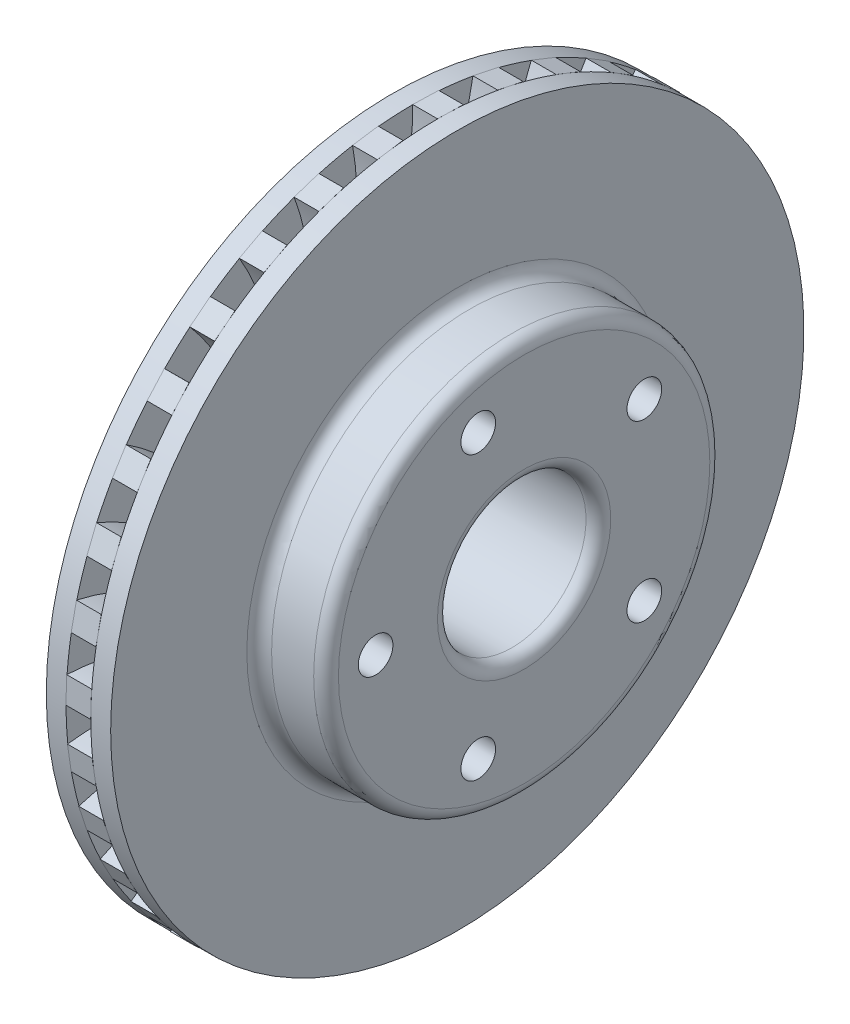
from build123d import *

# Parameters (mm, degrees)
BOSS_EXTRUDE1_DEPTH            = 10
CIRPATTERN1_COUNT              = 36
CUT_EXTRUDE1_REACH             = 215.623
SKETCH4_R                      = 7
CUT_EXTRUDE1_DIRECTION_2_DEPTH = 214.62310931


with BuildPart() as part:
    # Sketch1 → Revolve1 (revolve)
    with BuildSketch(Plane.XY, mode=Mode.PRIVATE) as revolve1_sk:
        with BuildLine():
            Line((13, 140), (13, 85))
            ThreePointArc((13, 85), (14.464466094, 81.464466094), (18, 80))
            Line((18, 80), (35, 80))
            ThreePointArc((35, 80), (38.535533906, 78.535533906), (40, 75))
            Line((40, 75), (40, 35))
            ThreePointArc((40, 35), (38.535533906, 31.464466094), (35, 30))
            Line((35, 30), (-35, 30))
            ThreePointArc((-35, 30), (-38.535533906, 31.464466094), (-40, 35))
            Line((-40, 35), (-40, 75))
            ThreePointArc((-40, 75), (-38.535533906, 78.535533906), (-35, 80))
            Line((-35, 80), (-18, 80))
            ThreePointArc((-18, 80), (-14.464466094, 81.464466094), (-13, 85))
            Line((-13, 85), (-13, 140))
            Line((-13, 140), (-5, 140))
            Line((-5, 140), (-5, 55))
            ThreePointArc((-5, 55), (-6.464466094, 51.464466094), (-10, 50))
            Line((-10, 50), (-25, 50))
            ThreePointArc((-25, 50), (-28.535533906, 48.535533906), (-30, 45))
            Line((-30, 45), (-30, 40))
            ThreePointArc((-30, 40), (-28.535533906, 36.464466094), (-25, 35))
            Line((-25, 35), (15, 35))
            ThreePointArc((15, 35), (18.535533906, 36.464466094), (20, 40))
            Line((20, 40), (20, 50))
            ThreePointArc((20, 50), (18.535533906, 53.535533906), (15, 55))
            Line((15, 55), (5, 55))
            Line((5, 55), (5, 140))
            Line((5, 140), (13, 140))
        make_face()
    revolve(revolve1_sk.sketch.rotate(Axis((-87.208333333, 0, 0), (1, 0, 0)), 90), axis=Axis((-87.208333333, 0, 0), (1, 0, 0)))

    # Sketch3 → Boss-Extrude1 (add)
    with BuildSketch(Plane(origin=(-5, 0, 0), x_dir=(0, 0, -1), z_dir=(1, 0, 0))):
        with BuildLine():
            Line((-0.000774849, 140.062187673), (10.499225151, 139.749248462))
            ThreePointArc((10.499225151, 139.749248462), (3.423085342, 107.196144199), (-13.953427537, 78.77373839))
            Line((-13.953427537, 78.77373839), (-21.268173939, 77.121104617))
            ThreePointArc((-21.268173939, 77.121104617), (-5.254701729, 106.773854542), (-0.000774849, 140.062187673))
        make_face()
    boss_extrude1 = extrude(amount=BOSS_EXTRUDE1_DEPTH)

    # CirPattern1: Boss-Extrude1 ×36 about axis
    cirpattern1_axis = Axis((0, 0, 0), (1, 0, 0))
    for i in range(1, CIRPATTERN1_COUNT):
        add(boss_extrude1.rotate(cirpattern1_axis, i * 360 / CIRPATTERN1_COUNT))

    # Cut-Extrude1: up to this face of the body (flat: up to its plane)
    cut_extrude1_end = Plane(part.part.faces().sort_by_distance((40, 0, -72.878679656))[0])
    # Sketch4 → Cut-Extrude1 (cut, up to the picked face)
    with BuildSketch(Plane.ZY.offset(40), mode=Mode.PRIVATE) as cut_extrude1_sk1:
        with Locations((60, 0)):
            Circle(SKETCH4_R)
    cut_extrude1_tool1 = split(extrude(cut_extrude1_sk1.sketch, amount=-CUT_EXTRUDE1_REACH, mode=Mode.PRIVATE), bisect_by=cut_extrude1_end, keep=Keep.BOTH, mode=Mode.PRIVATE)
    # Sketch4 → Cut-Extrude1 (cut, up to the picked face)
    with BuildSketch(Plane.ZY.offset(40), mode=Mode.PRIVATE) as cut_extrude1_sk2:
        with Locations((18.541019662, -57.063390978)):
            Circle(SKETCH4_R)
    cut_extrude1_tool2 = split(extrude(cut_extrude1_sk2.sketch, amount=-CUT_EXTRUDE1_REACH, mode=Mode.PRIVATE), bisect_by=cut_extrude1_end, keep=Keep.BOTH, mode=Mode.PRIVATE)
    # Sketch4 → Cut-Extrude1 (cut, up to the picked face)
    with BuildSketch(Plane.ZY.offset(40), mode=Mode.PRIVATE) as cut_extrude1_sk3:
        with Locations((-48.541019662, -35.267115138)):
            Circle(SKETCH4_R)
    cut_extrude1_tool3 = split(extrude(cut_extrude1_sk3.sketch, amount=-CUT_EXTRUDE1_REACH, mode=Mode.PRIVATE), bisect_by=cut_extrude1_end, keep=Keep.BOTH, mode=Mode.PRIVATE)
    # Sketch4 → Cut-Extrude1 (cut, up to the picked face)
    with BuildSketch(Plane.ZY.offset(40), mode=Mode.PRIVATE) as cut_extrude1_sk4:
        with Locations((-48.541019662, 35.267115138)):
            Circle(SKETCH4_R)
    cut_extrude1_tool4 = split(extrude(cut_extrude1_sk4.sketch, amount=-CUT_EXTRUDE1_REACH, mode=Mode.PRIVATE), bisect_by=cut_extrude1_end, keep=Keep.BOTH, mode=Mode.PRIVATE)
    # Sketch4 → Cut-Extrude1 (cut, up to the picked face)
    with BuildSketch(Plane.ZY.offset(40), mode=Mode.PRIVATE) as cut_extrude1_sk5:
        with Locations((18.541019662, 57.063390978)):
            Circle(SKETCH4_R)
    cut_extrude1_tool5 = split(extrude(cut_extrude1_sk5.sketch, amount=-CUT_EXTRUDE1_REACH, mode=Mode.PRIVATE), bisect_by=cut_extrude1_end, keep=Keep.BOTH, mode=Mode.PRIVATE)
    add(cut_extrude1_tool1.solids().sort_by(Axis((-40, 0, 60), (1, 0, 0)))[0], mode=Mode.SUBTRACT)
    add(cut_extrude1_tool2.solids().sort_by(Axis((-40, -57.063391, 18.54102), (1, 0, 0)))[0], mode=Mode.SUBTRACT)
    add(cut_extrude1_tool3.solids().sort_by(Axis((-40, -35.267115, -48.54102), (1, 0, 0)))[0], mode=Mode.SUBTRACT)
    add(cut_extrude1_tool4.solids().sort_by(Axis((-40, 35.267115, -48.54102), (1, 0, 0)))[0], mode=Mode.SUBTRACT)
    add(cut_extrude1_tool5.solids().sort_by(Axis((-40, 57.063391, 18.54102), (1, 0, 0)))[0], mode=Mode.SUBTRACT)

    # Sketch4 → Cut-Extrude1 direction 2 (cut)
    with BuildSketch(Plane.ZY.offset(40)):
        with Locations((60, 0)):
            Circle(SKETCH4_R)
        with Locations((18.541019662, -57.063390978)):
            Circle(SKETCH4_R)
        with Locations((-48.541019662, -35.267115138)):
            Circle(SKETCH4_R)
        with Locations((-48.541019662, 35.267115138)):
            Circle(SKETCH4_R)
        with Locations((18.541019662, 57.063390978)):
            Circle(SKETCH4_R)
    extrude(amount=CUT_EXTRUDE1_DIRECTION_2_DEPTH, mode=Mode.SUBTRACT)


solid = part.part
